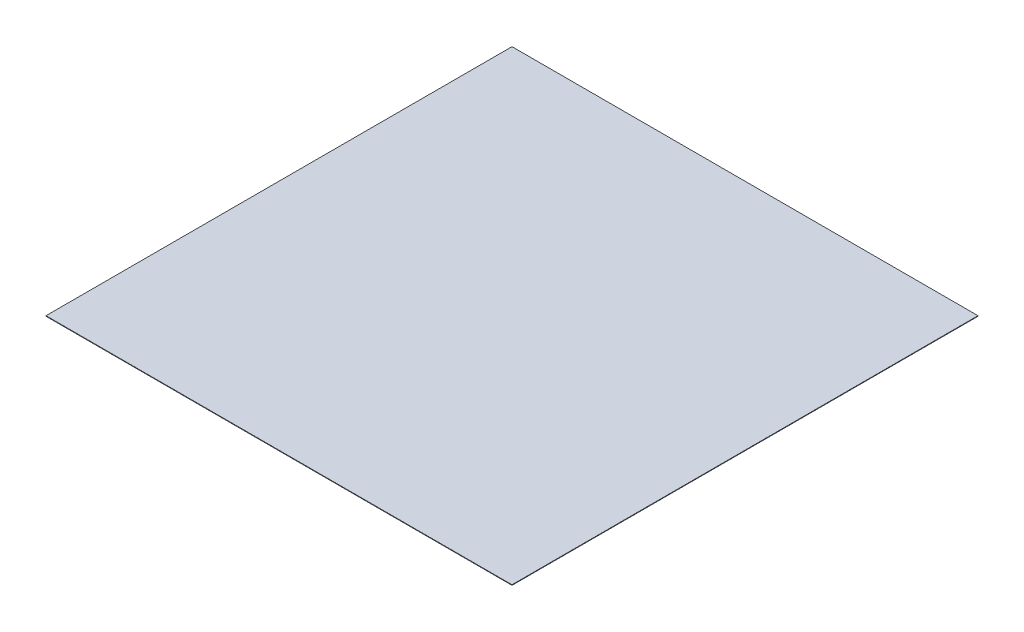
from build123d import *

# Parameters (mm, degrees)
CROQUIS1_W              = 9000
CROQUIS1_H              = 9000
SALIENTE_EXTRUIR1_DEPTH = 10


with BuildPart() as part:
    # Croquis1 → Saliente-Extruir1 (new body)
    with BuildSketch(Plane(origin=(0, 0, 0), x_dir=(1, 0, 0), z_dir=(0, 1, 0))):
        Rectangle(CROQUIS1_W, CROQUIS1_H)
    extrude(amount=SALIENTE_EXTRUIR1_DEPTH)


solid = part.part
